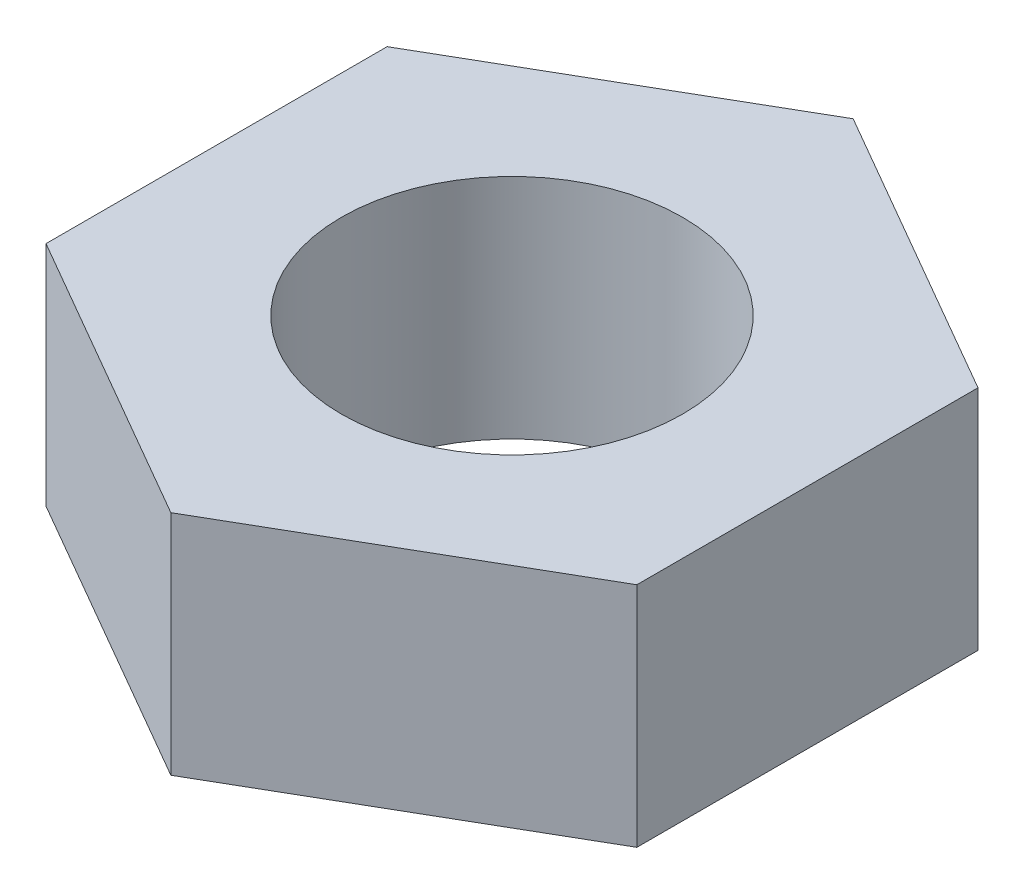
from build123d import *

# Parameters (mm, degrees)
SALIENTE_EXTRUIR1_DEPTH = 2
CROQUIS3_R              = 1.5
CORTAR_EXTRUIR1_DEPTH   = 6


with BuildPart() as part:
    # Croquis1 → Saliente-Extruir1 (new body)
    with BuildSketch(Plane(origin=(0, 0, 0), x_dir=(1, 0, 0), z_dir=(0, 1, 0))):
        Polygon((-2.598076211, 1.5), (-2.598076211, -1.5), (0, -3), (2.598076211, -1.5), (2.598076211, 1.5), (0, 3), align=None)
    extrude(amount=SALIENTE_EXTRUIR1_DEPTH)

    # Croquis3 → Cortar-Extruir1 (cut)
    with BuildSketch(Plane(origin=(0, 2, 0), x_dir=(1, 0, 0), z_dir=(0, 1, 0))):
        with Locations(Location((0, 0, 0), (0, 0, 270))):
            Circle(CROQUIS3_R)
    extrude(amount=-CORTAR_EXTRUIR1_DEPTH, mode=Mode.SUBTRACT)


solid = part.part
